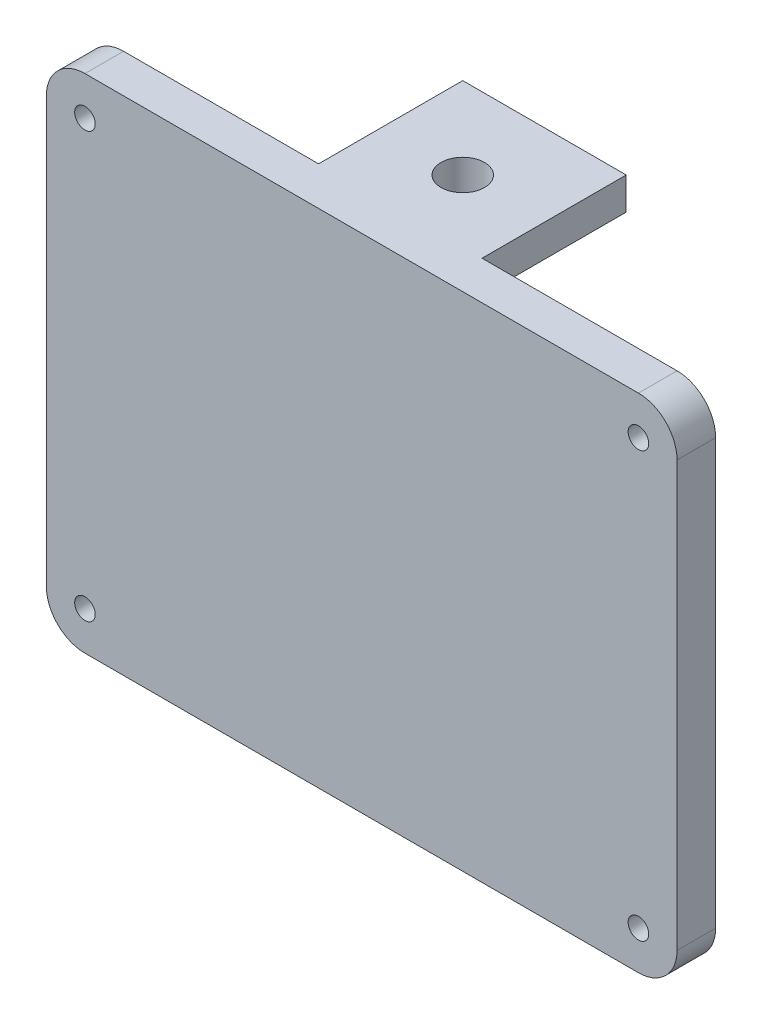
from build123d import *

# Parameters (mm, degrees)
SKETCH1_W               = 25.4
SKETCH1_H               = 25.4
BOSS_EXTRUDE1_DEPTH     = 5
F_1_4_CLEARANCE_HOLE1_D = 6.7564
SKETCH4_R               = 1.6
SKETCH4_W               = 25.4
SKETCH4_H               = 5
BOSS_EXTRUDE2_DEPTH     = 3
FILLET1_R               = 6


with BuildPart() as part:
    # Sketch1 → Boss-Extrude1 (new body)
    with BuildSketch(Plane(origin=(0, 0, 0), x_dir=(1, 0, 0), z_dir=(0, 1, 0))):
        Rectangle(SKETCH1_W, SKETCH1_H)
    extrude(amount=BOSS_EXTRUDE1_DEPTH)

    # 1/4 Clearance Hole1 (through all)
    with Locations(Plane(origin=(0, 5, 0), x_dir=(1, 0, 0), z_dir=(0, 1, 0))):
        with Locations((0, 0)):
            Hole(F_1_4_CLEARANCE_HOLE1_D / 2)

    # Sketch4 → Boss-Extrude2 (add, symmetric)
    # profile 1 of 2: a face of its own
    with BuildSketch(Plane.XY.offset(12.7)):
        Polygon((-49, 5), (-49, -73), (49, -73), (49, 5), (12.7, 5), (12.7, 0), (-12.7, 0), (-12.7, 5), align=None)
        with Locations((-43, -67)):
            Circle(SKETCH4_R, mode=Mode.SUBTRACT)
        with Locations((43, -67)):
            Circle(SKETCH4_R, mode=Mode.SUBTRACT)
        with Locations((-43, -1)):
            Circle(SKETCH4_R, mode=Mode.SUBTRACT)
        with Locations((43, -1)):
            Circle(SKETCH4_R, mode=Mode.SUBTRACT)
    # profile 2 of 2: a face of its own
    with BuildSketch(Plane.XY.offset(12.7)):
        with Locations((0, 2.5)):
            Rectangle(SKETCH4_W, SKETCH4_H)
    extrude(amount=BOSS_EXTRUDE2_DEPTH, both=True)

    # Fillet1
    fillet1_edges = [part.edges().sort_by_distance(p)[0] for p in [
        (-49, 5, 12.7),
        (49, 5, 12.7),
        (49, -73, 12.7),
        (-49, -73, 12.7),
    ]]
    fillet(fillet1_edges, radius=FILLET1_R)


solid = part.part
